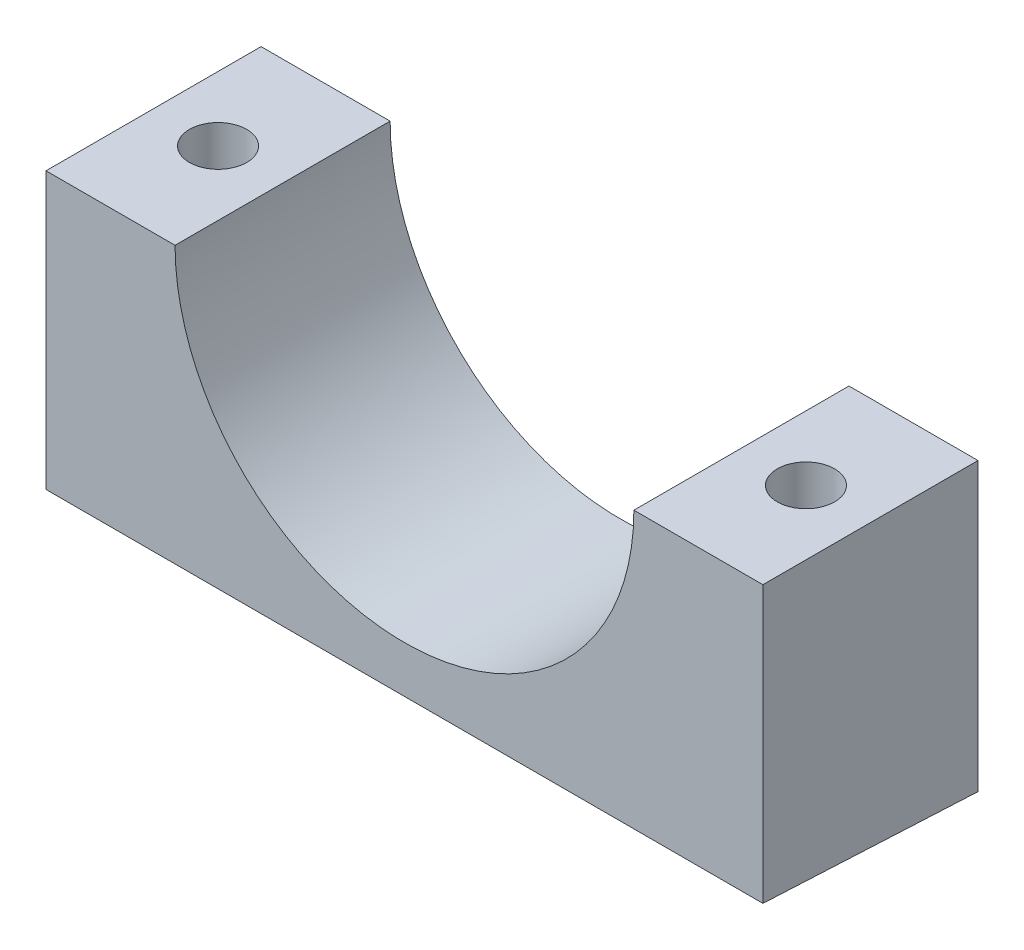
from build123d import *

# Parameters (mm, degrees)
SKETCH1_W               = 50
SKETCH1_H               = 20
BOSS_EXTRUDE1_DEPTH     = 15
CUT_EXTRUDE1_DEPTH      = 54.150729064
CUT_EXTRUDE1_DEPTH_BACK = 54.150729064
CUT_EXTRUDE2_DEPTH      = 15
SKETCH4_R               = 2
CUT_EXTRUDE3_DEPTH      = 10


with BuildPart() as part:
    # Sketch1 → Boss-Extrude1 (new body)
    with BuildSketch(Plane.XY):
        Rectangle(SKETCH1_W, SKETCH1_H)
    extrude(amount=BOSS_EXTRUDE1_DEPTH)

    # Sketch2 → Cut-Extrude1 (cut, two sides: drawn at the far end of the back side and taken through both)
    with BuildSketch(Plane(origin=(25, 0, 0), x_dir=(0, 0, -1), z_dir=(1, 0, 0)).offset(-CUT_EXTRUDE1_DEPTH_BACK)):
        Polygon((59.925140333, -12.996257017), (0, -10), (-15, -9.25), (-74.925140333, -6.253742983), (-80.917654366, -126.104023649), (53.932626299, -132.846537682), align=None)
    extrude(amount=CUT_EXTRUDE1_DEPTH + CUT_EXTRUDE1_DEPTH_BACK, mode=Mode.SUBTRACT)

    # Sketch3 → Cut-Extrude2 (cut)
    with BuildSketch(Plane(origin=(0, 0, 0), x_dir=(-1, 0, 0), z_dir=(0, 0, -1))):
        with BuildLine():
            Line((-16, 10), (16, 10))
            ThreePointArc((16, 10), (0, -6), (-16, 10))
        make_face()
    extrude(amount=-CUT_EXTRUDE2_DEPTH, mode=Mode.SUBTRACT)

    # Sketch4 → Cut-Extrude3 (cut)
    with BuildSketch(Plane(origin=(0, 10, 0), x_dir=(1, 0, 0), z_dir=(0, 1, 0))):
        with Locations(Location((20.5, -7.5, 0), (0, 0, 270))):
            Circle(SKETCH4_R)
    cut_extrude3 = extrude(amount=-CUT_EXTRUDE3_DEPTH, mode=Mode.SUBTRACT)

    # Mirror1: Cut-Extrude3 across plane
    add(cut_extrude3.mirror(Plane(origin=(0, 0, 0), x_dir=(0, 0, 1), z_dir=(1, 0, 0))), mode=Mode.SUBTRACT)


solid = part.part
